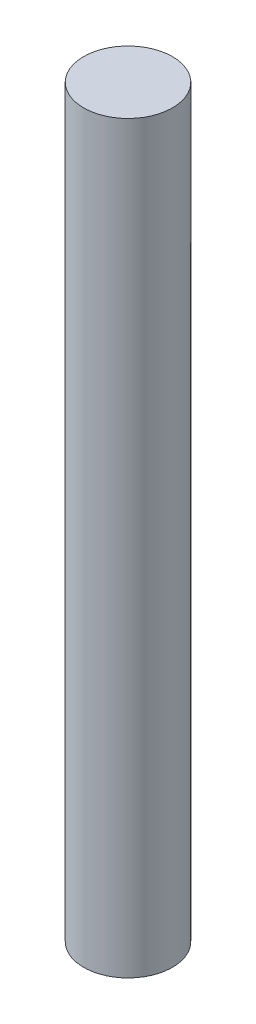
from build123d import *

# Parameters (mm, degrees)
SKETCH1_W = 2.5
SKETCH1_H = 41.9


with BuildPart() as part:
    # Sketch1 → Revolve1 (revolve)
    with BuildSketch(Plane.XY, mode=Mode.PRIVATE) as revolve1_sk:
        with Locations((1.25, -5.528930572)):
            Rectangle(SKETCH1_W, SKETCH1_H)
    revolve(revolve1_sk.sketch.rotate(Axis((0, -26.478930572, 0), (0, 1, 0)), 90), axis=Axis((0, -26.478930572, 0), (0, 1, 0)))


solid = part.part
